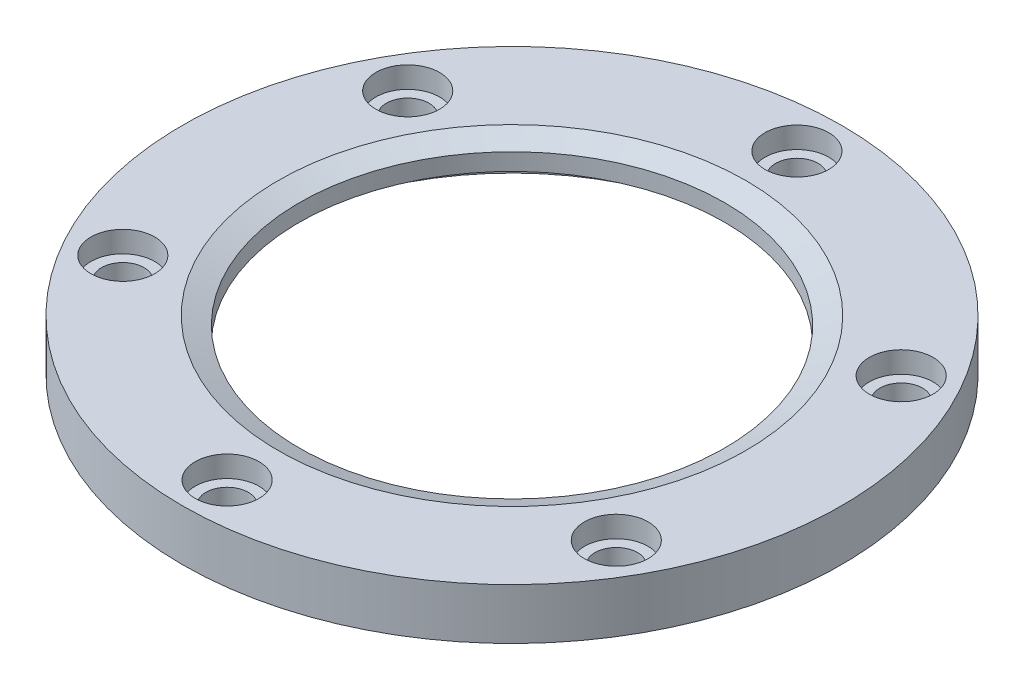
from build123d import *

# Parameters (mm, degrees)
SKETCH_1_R                    = 77.5
EXTRUDE_D155_DEPTH            = 12
SKETCH_3_R                    = 58
CUT_EXTRUDE_D116_2_DEPTH      = 6
HOLE_WIZARD_M10_6_D           = 10
HOLE_WIZARD_M10_6_CBORE_D     = 15
HOLE_WIZARD_M10_6_CBORE_DEPTH = 5
PATTERN_CIRCULAR_M10_6_COUNT  = 6


with BuildPart() as part:
    # 草图1 → D155 观察窗外盖 (new body)
    with BuildSketch(Plane(origin=(0, 0, 0), x_dir=(1, 0, 0), z_dir=(0, 1, 0))):
        with Locations(Location((0, 0, 0), (0, 0, 270))):
            Circle(SKETCH_1_R)
    extrude(amount=EXTRUDE_D155_DEPTH)

    # 草图2 → D100 内径切除 (revolve, cut)
    with BuildSketch(Plane.XY, mode=Mode.PRIVATE) as cut_revolve_d100_sk:
        Polygon((50, 10), (55, 12), (50, 12), (0, 12), (0, 0), (50, 0), align=None)
    revolve(cut_revolve_d100_sk.sketch.rotate(Axis((0, 0, 0), (0, 1, 0)), 90), axis=Axis((0, 0, 0), (0, 1, 0)), mode=Mode.SUBTRACT)

    # 草图3 → D116*2 橡胶垫(外径) (cut)
    with BuildSketch(Plane.XZ):
        with Locations(Location((0, 0, 0), (0, 0, 270))):
            Circle(SKETCH_3_R)
    extrude(amount=-CUT_EXTRUDE_D116_2_DEPTH, mode=Mode.SUBTRACT)

    # M10*6 柱形沉头孔 (through all)
    with Locations(Plane(origin=(0, 12, 0), x_dir=(1, 0, 0), z_dir=(0, 1, 0))):
        with Locations((0, 67)):
            hole_wizard_m10_6 = CounterBoreHole(HOLE_WIZARD_M10_6_D / 2, HOLE_WIZARD_M10_6_CBORE_D / 2, HOLE_WIZARD_M10_6_CBORE_DEPTH)

    # M10*6 圆周阵列: M10*6 柱形沉头孔 ×6 about axis
    pattern_circular_m10_6_axis = Axis((0, 0, 0), (0, 1, 0))
    for i in range(1, PATTERN_CIRCULAR_M10_6_COUNT):
        add(hole_wizard_m10_6.rotate(pattern_circular_m10_6_axis, i * 360 / PATTERN_CIRCULAR_M10_6_COUNT), mode=Mode.SUBTRACT)


solid = part.part
